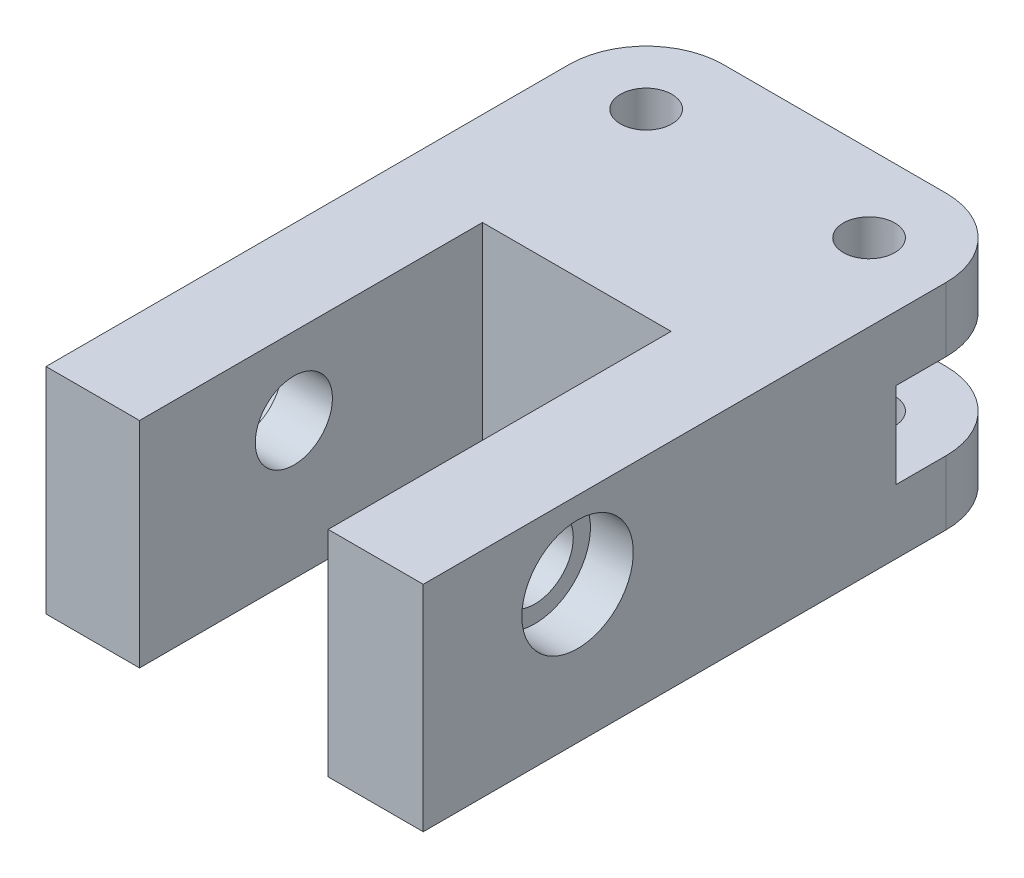
from build123d import *

# Parameters (mm, degrees)
SKETCH_1_W               = 44
SKETCH_1_H               = 25
EXTRUDE_1_DEPTH          = 70
SKETCH_2_W               = 22
SKETCH_2_H               = 25
CUT_EXTRUDE_1_DEPTH      = 40
SKETCH_3_R               = 4.5
CUT_EXTRUDE_2_DEPTH      = 50
SKETCH_4_R               = 6.5
CUT_EXTRUDE_4_DEPTH      = 5
SKETCH_5_R               = 3
CUT_EXTRUDE_5_DEPTH      = 29
CUT_EXTRUDE_6_DEPTH      = 5
CUT_EXTRUDE_6_DEPTH_BACK = 5


with BuildPart() as part:
    # 스케치1 → 보스-돌출1 (new body)
    with BuildSketch(Plane.XY):
        Rectangle(SKETCH_1_W, SKETCH_1_H)
    extrude(amount=EXTRUDE_1_DEPTH)

    # 스케치2 → 컷-돌출1 (cut)
    with BuildSketch(Plane.XY.offset(70)):
        with Locations((-0.092136373, 0)):
            Rectangle(SKETCH_2_W, SKETCH_2_H)
    extrude(amount=-CUT_EXTRUDE_1_DEPTH, mode=Mode.SUBTRACT)

    # 스케치3 → 컷-돌출2 (cut)
    with BuildSketch(Plane(origin=(22, 0, 0), x_dir=(0, 0, -1), z_dir=(1, 0, 0))):
        with Locations((-52, 3.5)):
            Circle(SKETCH_3_R)
    extrude(amount=-CUT_EXTRUDE_2_DEPTH, mode=Mode.SUBTRACT)

    # 스케치4 → 컷-돌출4 (cut)
    with BuildSketch(Plane.ZY.offset(-22)):
        with Locations((52, 3.5)):
            Circle(SKETCH_4_R)
    cut_extrude_4 = extrude(amount=CUT_EXTRUDE_4_DEPTH, mode=Mode.SUBTRACT)

    # 스케치5 → 컷-돌출5 (cut)
    with BuildSketch(Plane(origin=(0, 12.5, 0), x_dir=(1, 0, 0), z_dir=(0, 1, 0))):
        with Locations((13, -9)):
            Circle(SKETCH_5_R)
        with BuildLine():
            Line((13, 12.355747981), (13, 0))
            ThreePointArc((13, 0), (19.363961031, -2.636038969), (22, -9))
            Line((22, -9), (34.355747981, -9))
            ThreePointArc((34.355747981, -9), (28.100794214, 6.100794214), (13, 12.355747981))
        make_face()
    cut_extrude_5 = extrude(amount=-CUT_EXTRUDE_5_DEPTH, mode=Mode.SUBTRACT)

    # 대칭 복사2: 컷-돌출4, 컷-돌출5 across plane
    add(cut_extrude_4.mirror(Plane(origin=(0, 0, 0), x_dir=(0, 0, 1), z_dir=(1, 0, 0))), mode=Mode.SUBTRACT)
    add(cut_extrude_5.mirror(Plane(origin=(0, 0, 0), x_dir=(0, 0, 1), z_dir=(1, 0, 0))), mode=Mode.SUBTRACT)

    # 스케치6 → 컷-돌출6 (cut, two sides: drawn at the far end of the back side and taken through both)
    with BuildSketch(Plane(origin=(0, 0, 0), x_dir=(1, 0, 0), z_dir=(0, 1, 0)).offset(-CUT_EXTRUDE_6_DEPTH_BACK)):
        Polygon((2.5, -19.5), (2.5, 5.258137662), (22, 5.258137662), (22, -14.849242405), (17.349242405, -19.5), align=None)
        Polygon((-22, -14.849242405), (-22, 5.258137662), (-2.5, 5.258137662), (-2.5, -19.5), (-17.349242405, -19.5), align=None)
    extrude(amount=CUT_EXTRUDE_6_DEPTH + CUT_EXTRUDE_6_DEPTH_BACK, mode=Mode.SUBTRACT)


solid = part.part
